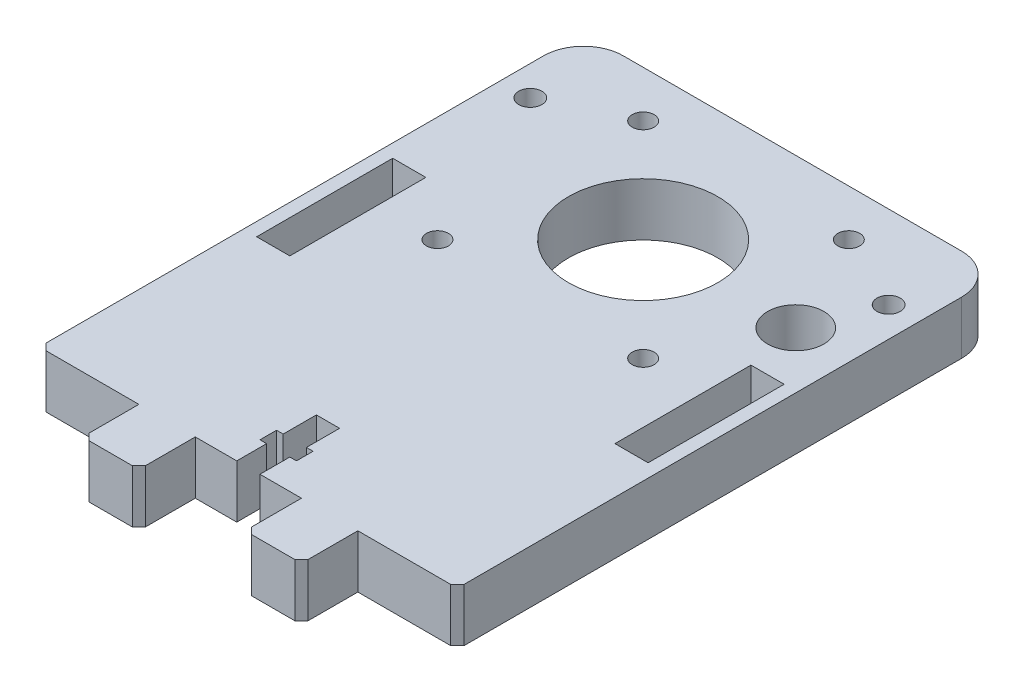
from build123d import *

# Parameters (mm, degrees)
SKETCH1_R      = 1.65
SKETCH1_R_2    = 4.25
SKETCH1_R_3    = 11.25
SKETCH1_W      = 5
SKETCH1_H      = 20.5
EXTRUDE1_DEPTH = 8
SKETCH2_R      = 1
EXTRUDE2_DEPTH = 1
SKETCH3_R      = 1.75
EXTRUDE3_DEPTH = 10


with BuildPart() as part:
    # Sketch1 → Extrude1 (new body)
    with BuildSketch(Plane(origin=(0, 0, 0), x_dir=(1, 0, 0), z_dir=(0, 1, 0))):
        with BuildLine():
            Line((4.894189333, 14.494689664), (4.894189333, 89.494689664))
            ThreePointArc((4.894189333, 89.494689664), (6.651548646, 93.737330351), (10.894189333, 95.494689664))
            Line((10.894189333, 95.494689664), (61.894189333, 95.494689664))
            ThreePointArc((61.894189333, 95.494689664), (66.136830021, 93.737330351), (67.894189333, 89.494689664))
            Line((67.894189333, 89.494689664), (67.894189333, 14.494689664))
            Line((67.894189333, 14.494689664), (66.894189333, 13.494689664))
            Line((66.894189333, 13.494689664), (52.894189333, 13.494689664))
            Line((52.894189333, 13.494689664), (52.894189333, 5.994689664))
            Line((52.894189333, 5.994689664), (51.894189333, 4.994689664))
            Line((51.894189333, 4.994689664), (45.394189333, 4.994689664))
            Line((45.394189333, 4.994689664), (44.394189333, 5.994689664))
            Line((44.394189333, 5.994689664), (44.394189333, 13.494689664))
            Line((44.394189333, 13.494689664), (38.144189333, 13.494689664))
            Line((38.144189333, 13.494689664), (38.144189333, 17.994689664))
            Line((38.144189333, 17.994689664), (39.144189333, 17.994689664))
            Line((39.144189333, 17.994689664), (39.144189333, 20.494689664))
            Line((39.144189333, 20.494689664), (38.144189333, 20.494689664))
            Line((38.144189333, 20.494689664), (38.144189333, 25.494689664))
            Line((38.144189333, 25.494689664), (34.644189333, 25.494689664))
            Line((34.644189333, 25.494689664), (34.644189333, 20.494689664))
            Line((34.644189333, 20.494689664), (33.644189333, 20.494689664))
            Line((33.644189333, 20.494689664), (33.644189333, 17.994689664))
            Line((33.644189333, 17.994689664), (34.644189333, 17.994689664))
            Line((34.644189333, 17.994689664), (34.644189333, 13.494689664))
            Line((34.644189333, 13.494689664), (28.394189333, 13.494689664))
            Line((28.394189333, 13.494689664), (28.394189333, 5.994689664))
            Line((28.394189333, 5.994689664), (27.394189333, 4.994689664))
            Line((27.394189333, 4.994689664), (20.894189333, 4.994689664))
            Line((20.894189333, 4.994689664), (19.894189333, 5.994689664))
            Line((19.894189333, 5.994689664), (19.894189333, 13.494689664))
            Line((19.894189333, 13.494689664), (5.894189333, 13.494689664))
            Line((5.894189333, 13.494689664), (4.894189333, 14.494689664))
        make_face()
        with Locations(Location((51.894189333, 88.494689664, 0), (0, 0, 270))):
            Circle(SKETCH1_R, mode=Mode.SUBTRACT)
        with Locations(Location((20.894189333, 88.494689664, 0), (0, 0, 270))):
            Circle(SKETCH1_R, mode=Mode.SUBTRACT)
        with Locations(Location((51.894189333, 57.494689664, 0), (0, 0, 270))):
            Circle(SKETCH1_R, mode=Mode.SUBTRACT)
        with Locations(Location((20.894189333, 57.494689664, 0), (0, 0, 270))):
            Circle(SKETCH1_R, mode=Mode.SUBTRACT)
        with Locations(Location((59.394189333, 72.994689664, 0), (0, 0, 270))):
            Circle(SKETCH1_R_2, mode=Mode.SUBTRACT)
        with Locations(Location((36.394189333, 72.994689664, 0), (0, 0, 270))):
            Circle(SKETCH1_R_3, mode=Mode.SUBTRACT)
        with Locations((9.394189333, 54.494689664)):
            Rectangle(SKETCH1_W, SKETCH1_H, mode=Mode.SUBTRACT)
        with Locations((63.394189333, 54.494689664)):
            Rectangle(SKETCH1_W, SKETCH1_H, mode=Mode.SUBTRACT)
    extrude(amount=EXTRUDE1_DEPTH)

    # Sketch2 → Extrude2 (cut)
    with BuildSketch(Plane.XY.offset(-25.494689664)):
        with Locations((36.394189333, 4)):
            Circle(SKETCH2_R)
    extrude(amount=-EXTRUDE2_DEPTH, mode=Mode.SUBTRACT)

    # Sketch3 → Extrude3 (cut)
    with BuildSketch(Plane(origin=(0, 8, 0), x_dir=(1, 0, 0), z_dir=(0, 1, 0))):
        with Locations(Location((9.394189333, 82.994689664, 0), (0, 0, 270))):
            Circle(SKETCH3_R)
        with Locations(Location((63.394189333, 82.994689664, 0), (0, 0, 270))):
            Circle(SKETCH3_R)
    extrude(amount=-EXTRUDE3_DEPTH, mode=Mode.SUBTRACT)


solid = part.part
